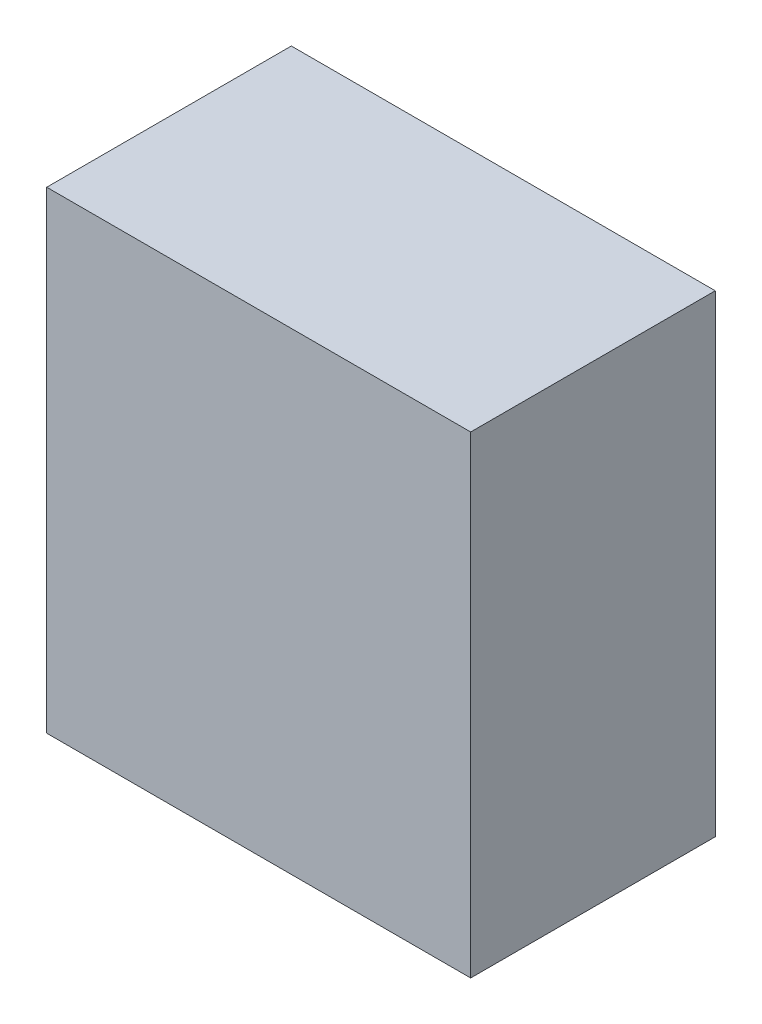
from build123d import *

# Parameters (mm, degrees)
ESQUISSE1_W        = 52
ESQUISSE1_H        = 58
BOSS_EXTRU_1_DEPTH = 30


with BuildPart() as part:
    # Esquisse1 → Boss.-Extru.1 (new body)
    with BuildSketch(Plane.XY):
        Rectangle(ESQUISSE1_W, ESQUISSE1_H)
    extrude(amount=BOSS_EXTRU_1_DEPTH)


solid = part.part
